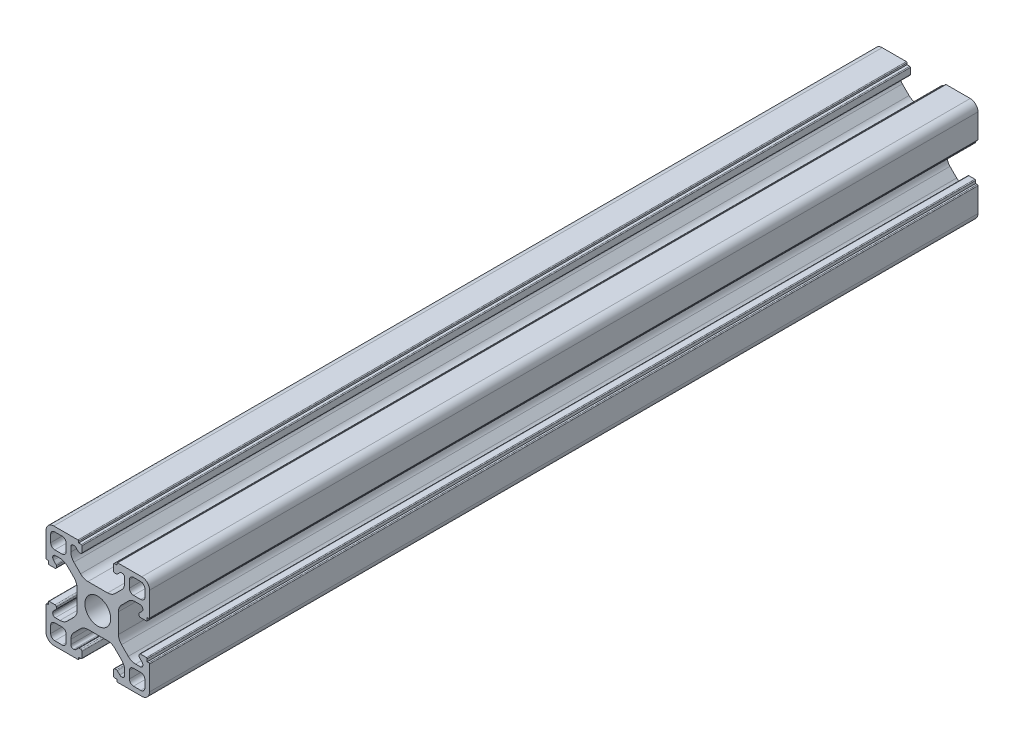
from build123d import *

# Parameters (mm, degrees)
EXTRUDE_1_DEPTH = 160


with BuildPart() as part:
    # Эскиз1 → Бобышка-Вытянуть1 (new body)
    with BuildSketch(Plane.XY):
        with BuildLine():
            Line((-31.105150957, 65.209647948), (-29.206370287, 65.209647948))
            ThreePointArc((-29.206370287, 65.209647948), (-28.441003423, 65.361888883), (-27.792156725, 65.795434385))
            Line((-27.792156725, 65.795434385), (-26.490937394, 67.096653716))
            ThreePointArc((-26.490937394, 67.096653716), (-26.057391892, 67.745500414), (-25.905150957, 68.510867279))
            Line((-25.905150957, 68.510867279), (-25.905150957, 69.409647948))
            ThreePointArc((-25.905150957, 69.409647948), (-26.051597566, 69.763201338), (-26.405150957, 69.909647948))
            Line((-26.405150957, 69.909647948), (-26.508044175, 69.909647948))
            ThreePointArc((-26.508044175, 69.909647948), (-26.699385892, 69.871587714), (-26.861597566, 69.763201338))
            Line((-26.861597566, 69.763201338), (-27.341927652, 69.282871252))
            ThreePointArc((-27.341927652, 69.282871252), (-27.423033489, 69.228678065), (-27.518704347, 69.209647948))
            Line((-27.518704347, 69.209647948), (-27.805150957, 69.209647948))
            ThreePointArc((-27.805150957, 69.209647948), (-27.981927652, 69.282871252), (-28.055150957, 69.459647948))
            Line((-28.055150957, 69.459647948), (-28.055150957, 70.608718768))
            ThreePointArc((-28.055150957, 70.608718768), (-28.011216974, 70.714784785), (-27.905150957, 70.758718768))
            Line((-27.905150957, 70.758718768), (-27.405150957, 70.758718768))
            Line((-27.405150957, 70.758718768), (-27.405150957, 71.059647948))
            ThreePointArc((-27.405150957, 71.059647948), (-27.361216974, 71.165713965), (-27.255150957, 71.209647948))
            Line((-27.255150957, 71.209647948), (-22.605150957, 71.209647948))
            ThreePointArc((-22.605150957, 71.209647948), (-21.544490785, 70.770308119), (-21.105150957, 69.709647948))
            Line((-21.105150957, 69.709647948), (-21.105150957, 65.059647948))
            ThreePointArc((-21.105150957, 65.059647948), (-21.149084939, 64.953581931), (-21.255150957, 64.909647948))
            Line((-21.255150957, 64.909647948), (-21.556080136, 64.909647948))
            Line((-21.556080136, 64.909647948), (-21.556080136, 64.409647948))
            ThreePointArc((-21.556080136, 64.409647948), (-21.600014119, 64.303581931), (-21.706080136, 64.259647948))
            Line((-21.706080136, 64.259647948), (-22.855150957, 64.259647948))
            ThreePointArc((-22.855150957, 64.259647948), (-23.031927652, 64.332871252), (-23.105150957, 64.509647948))
            Line((-23.105150957, 64.509647948), (-23.105150957, 64.796094557))
            ThreePointArc((-23.105150957, 64.796094557), (-23.08612084, 64.891765415), (-23.031927652, 64.972871252))
            Line((-23.031927652, 64.972871252), (-22.551597566, 65.453201338))
            ThreePointArc((-22.551597566, 65.453201338), (-22.44321119, 65.615413013), (-22.405150957, 65.806754729))
            Line((-22.405150957, 65.806754729), (-22.405150957, 65.909647948))
            ThreePointArc((-22.405150957, 65.909647948), (-22.551597566, 66.263201338), (-22.905150957, 66.409647948))
            Line((-22.905150957, 66.409647948), (-23.803931626, 66.409647948))
            ThreePointArc((-23.803931626, 66.409647948), (-24.56929849, 66.257407013), (-25.218145188, 65.82386151))
            Line((-25.218145188, 65.82386151), (-26.519364519, 64.522642179))
            ThreePointArc((-26.519364519, 64.522642179), (-26.952910022, 63.873795482), (-27.105150957, 63.108428617))
            Line((-27.105150957, 63.108428617), (-27.105150957, 61.209647948))
            Line((-27.105150957, 61.209647948), (-27.105150957, 59.310867279))
            ThreePointArc((-27.105150957, 59.310867279), (-26.952910022, 58.545500414), (-26.519364519, 57.896653716))
            Line((-26.519364519, 57.896653716), (-25.218145188, 56.595434385))
            ThreePointArc((-25.218145188, 56.595434385), (-24.56929849, 56.161888883), (-23.803931626, 56.009647948))
            Line((-23.803931626, 56.009647948), (-22.905150957, 56.009647948))
            ThreePointArc((-22.905150957, 56.009647948), (-22.551597566, 56.156094557), (-22.405150957, 56.509647948))
            Line((-22.405150957, 56.509647948), (-22.405150957, 56.612541166))
            ThreePointArc((-22.405150957, 56.612541166), (-22.44321119, 56.803882883), (-22.551597566, 56.966094557))
            Line((-22.551597566, 56.966094557), (-23.031927652, 57.446424643))
            ThreePointArc((-23.031927652, 57.446424643), (-23.08612084, 57.52753048), (-23.105150957, 57.623201338))
            Line((-23.105150957, 57.623201338), (-23.105150957, 57.909647948))
            ThreePointArc((-23.105150957, 57.909647948), (-23.031927652, 58.086424643), (-22.855150957, 58.159647948))
            Line((-22.855150957, 58.159647948), (-21.706080136, 58.159647948))
            ThreePointArc((-21.706080136, 58.159647948), (-21.600014119, 58.115713965), (-21.556080136, 58.009647948))
            Line((-21.556080136, 58.009647948), (-21.556080136, 57.509647948))
            Line((-21.556080136, 57.509647948), (-21.255150957, 57.509647948))
            ThreePointArc((-21.255150957, 57.509647948), (-21.149084939, 57.465713965), (-21.105150957, 57.359647948))
            Line((-21.105150957, 57.359647948), (-21.105150957, 52.709647948))
            ThreePointArc((-21.105150957, 52.709647948), (-21.544490785, 51.648987776), (-22.605150957, 51.209647948))
            Line((-22.605150957, 51.209647948), (-27.255150957, 51.209647948))
            ThreePointArc((-27.255150957, 51.209647948), (-27.361216974, 51.253581931), (-27.405150957, 51.359647948))
            Line((-27.405150957, 51.359647948), (-27.405150957, 51.660577127))
            Line((-27.405150957, 51.660577127), (-27.905150957, 51.660577127))
            ThreePointArc((-27.905150957, 51.660577127), (-28.011216974, 51.70451111), (-28.055150957, 51.810577127))
            Line((-28.055150957, 51.810577127), (-28.055150957, 52.959647948))
            ThreePointArc((-28.055150957, 52.959647948), (-27.981927652, 53.136424643), (-27.805150957, 53.209647948))
            Line((-27.805150957, 53.209647948), (-27.518704347, 53.209647948))
            ThreePointArc((-27.518704347, 53.209647948), (-27.423033489, 53.190617831), (-27.341927652, 53.136424643))
            Line((-27.341927652, 53.136424643), (-26.861597566, 52.656094557))
            ThreePointArc((-26.861597566, 52.656094557), (-26.699385892, 52.547708181), (-26.508044175, 52.509647948))
            Line((-26.508044175, 52.509647948), (-26.405150957, 52.509647948))
            ThreePointArc((-26.405150957, 52.509647948), (-26.051597566, 52.656094557), (-25.905150957, 53.009647948))
            Line((-25.905150957, 53.009647948), (-25.905150957, 53.908428617))
            ThreePointArc((-25.905150957, 53.908428617), (-26.057391892, 54.673795482), (-26.490937394, 55.322642179))
            Line((-26.490937394, 55.322642179), (-27.792156725, 56.62386151))
            ThreePointArc((-27.792156725, 56.62386151), (-28.441003423, 57.057407013), (-29.206370287, 57.209647948))
            Line((-29.206370287, 57.209647948), (-31.105150957, 57.209647948))
            Line((-31.105150957, 57.209647948), (-33.003931626, 57.209647948))
            ThreePointArc((-33.003931626, 57.209647948), (-33.76929849, 57.057407013), (-34.418145188, 56.62386151))
            Line((-34.418145188, 56.62386151), (-35.719364519, 55.322642179))
            ThreePointArc((-35.719364519, 55.322642179), (-36.152910022, 54.673795482), (-36.305150957, 53.908428617))
            Line((-36.305150957, 53.908428617), (-36.305150957, 53.009647948))
            ThreePointArc((-36.305150957, 53.009647948), (-36.158704347, 52.656094557), (-35.805150957, 52.509647948))
            Line((-35.805150957, 52.509647948), (-35.702257738, 52.509647948))
            ThreePointArc((-35.702257738, 52.509647948), (-35.510916022, 52.547708181), (-35.348704347, 52.656094557))
            Line((-35.348704347, 52.656094557), (-34.868374261, 53.136424643))
            ThreePointArc((-34.868374261, 53.136424643), (-34.787268424, 53.190617831), (-34.691597566, 53.209647948))
            Line((-34.691597566, 53.209647948), (-34.405150957, 53.209647948))
            ThreePointArc((-34.405150957, 53.209647948), (-34.228374261, 53.136424643), (-34.155150957, 52.959647948))
            Line((-34.155150957, 52.959647948), (-34.155150957, 51.810577127))
            ThreePointArc((-34.155150957, 51.810577127), (-34.199084939, 51.70451111), (-34.305150957, 51.660577127))
            Line((-34.305150957, 51.660577127), (-34.805150957, 51.660577127))
            Line((-34.805150957, 51.660577127), (-34.805150957, 51.359647948))
            ThreePointArc((-34.805150957, 51.359647948), (-34.849084939, 51.253581931), (-34.955150957, 51.209647948))
            Line((-34.955150957, 51.209647948), (-39.605150957, 51.209647948))
            ThreePointArc((-39.605150957, 51.209647948), (-40.665811128, 51.648987776), (-41.105150957, 52.709647948))
            Line((-41.105150957, 52.709647948), (-41.105150957, 57.359647948))
            ThreePointArc((-41.105150957, 57.359647948), (-41.061216974, 57.465713965), (-40.955150957, 57.509647948))
            Line((-40.955150957, 57.509647948), (-40.654221777, 57.509647948))
            Line((-40.654221777, 57.509647948), (-40.654221777, 58.009647948))
            ThreePointArc((-40.654221777, 58.009647948), (-40.610287794, 58.115713965), (-40.504221777, 58.159647948))
            Line((-40.504221777, 58.159647948), (-39.355150957, 58.159647948))
            ThreePointArc((-39.355150957, 58.159647948), (-39.178374261, 58.086424643), (-39.105150957, 57.909647948))
            Line((-39.105150957, 57.909647948), (-39.105150957, 57.623201338))
            ThreePointArc((-39.105150957, 57.623201338), (-39.124181073, 57.52753048), (-39.178374261, 57.446424643))
            Line((-39.178374261, 57.446424643), (-39.658704347, 56.966094557))
            ThreePointArc((-39.658704347, 56.966094557), (-39.767090723, 56.803882883), (-39.805150957, 56.612541166))
            Line((-39.805150957, 56.612541166), (-39.805150957, 56.509647948))
            ThreePointArc((-39.805150957, 56.509647948), (-39.658704347, 56.156094557), (-39.305150957, 56.009647948))
            Line((-39.305150957, 56.009647948), (-38.406370287, 56.009647948))
            ThreePointArc((-38.406370287, 56.009647948), (-37.641003423, 56.161888883), (-36.992156725, 56.595434385))
            Line((-36.992156725, 56.595434385), (-35.690937394, 57.896653716))
            ThreePointArc((-35.690937394, 57.896653716), (-35.257391892, 58.545500414), (-35.105150957, 59.310867279))
            Line((-35.105150957, 59.310867279), (-35.105150957, 61.209647948))
            Line((-35.105150957, 61.209647948), (-35.105150957, 63.108428617))
            ThreePointArc((-35.105150957, 63.108428617), (-35.257391892, 63.873795482), (-35.690937394, 64.522642179))
            Line((-35.690937394, 64.522642179), (-36.992156725, 65.82386151))
            ThreePointArc((-36.992156725, 65.82386151), (-37.641003423, 66.257407013), (-38.406370287, 66.409647948))
            Line((-38.406370287, 66.409647948), (-39.305150957, 66.409647948))
            ThreePointArc((-39.305150957, 66.409647948), (-39.658704347, 66.263201338), (-39.805150957, 65.909647948))
            Line((-39.805150957, 65.909647948), (-39.805150957, 65.806754729))
            ThreePointArc((-39.805150957, 65.806754729), (-39.767090723, 65.615413013), (-39.658704347, 65.453201338))
            Line((-39.658704347, 65.453201338), (-39.178374261, 64.972871252))
            ThreePointArc((-39.178374261, 64.972871252), (-39.124181073, 64.891765415), (-39.105150957, 64.796094557))
            Line((-39.105150957, 64.796094557), (-39.105150957, 64.509647948))
            ThreePointArc((-39.105150957, 64.509647948), (-39.178374261, 64.332871252), (-39.355150957, 64.259647948))
            Line((-39.355150957, 64.259647948), (-40.504221777, 64.259647948))
            ThreePointArc((-40.504221777, 64.259647948), (-40.610287794, 64.303581931), (-40.654221777, 64.409647948))
            Line((-40.654221777, 64.409647948), (-40.654221777, 64.909647948))
            Line((-40.654221777, 64.909647948), (-40.955150957, 64.909647948))
            ThreePointArc((-40.955150957, 64.909647948), (-41.061216974, 64.953581931), (-41.105150957, 65.059647948))
            Line((-41.105150957, 65.059647948), (-41.105150957, 69.709647948))
            ThreePointArc((-41.105150957, 69.709647948), (-40.665811128, 70.770308119), (-39.605150957, 71.209647948))
            Line((-39.605150957, 71.209647948), (-34.955150957, 71.209647948))
            ThreePointArc((-34.955150957, 71.209647948), (-34.849084939, 71.165713965), (-34.805150957, 71.059647948))
            Line((-34.805150957, 71.059647948), (-34.805150957, 70.758718768))
            Line((-34.805150957, 70.758718768), (-34.305150957, 70.758718768))
            ThreePointArc((-34.305150957, 70.758718768), (-34.199084939, 70.714784785), (-34.155150957, 70.608718768))
            Line((-34.155150957, 70.608718768), (-34.155150957, 69.459647948))
            ThreePointArc((-34.155150957, 69.459647948), (-34.228374261, 69.282871252), (-34.405150957, 69.209647948))
            Line((-34.405150957, 69.209647948), (-34.691597566, 69.209647948))
            ThreePointArc((-34.691597566, 69.209647948), (-34.787268424, 69.228678065), (-34.868374261, 69.282871252))
            Line((-34.868374261, 69.282871252), (-35.348704347, 69.763201338))
            ThreePointArc((-35.348704347, 69.763201338), (-35.510916022, 69.871587714), (-35.702257738, 69.909647948))
            Line((-35.702257738, 69.909647948), (-35.805150957, 69.909647948))
            ThreePointArc((-35.805150957, 69.909647948), (-36.158704347, 69.763201338), (-36.305150957, 69.409647948))
            Line((-36.305150957, 69.409647948), (-36.305150957, 68.510867279))
            ThreePointArc((-36.305150957, 68.510867279), (-36.152910022, 67.745500414), (-35.719364519, 67.096653716))
            Line((-35.719364519, 67.096653716), (-34.418145188, 65.795434385))
            ThreePointArc((-34.418145188, 65.795434385), (-33.76929849, 65.361888883), (-33.003931626, 65.209647948))
            Line((-33.003931626, 65.209647948), (-31.105150957, 65.209647948))
        make_face()
        with BuildLine():
            Line((-24.205150957, 67.309647948), (-22.805150957, 67.309647948))
            ThreePointArc((-22.805150957, 67.309647948), (-22.239465532, 67.543962523), (-22.005150957, 68.109647948))
            Line((-22.005150957, 68.109647948), (-22.005150957, 69.509647948))
            ThreePointArc((-22.005150957, 69.509647948), (-22.239465532, 70.075333373), (-22.805150957, 70.309647948))
            Line((-22.805150957, 70.309647948), (-24.205150957, 70.309647948))
            ThreePointArc((-24.205150957, 70.309647948), (-24.770836381, 70.075333373), (-25.005150957, 69.509647948))
            Line((-25.005150957, 69.509647948), (-25.005150957, 68.109647948))
            ThreePointArc((-25.005150957, 68.109647948), (-24.770836381, 67.543962523), (-24.205150957, 67.309647948))
        make_face(mode=Mode.SUBTRACT)
        with BuildLine():
            Line((-25.005150957, 54.309647948), (-25.005150957, 52.909647948))
            ThreePointArc((-25.005150957, 52.909647948), (-24.770836381, 52.343962523), (-24.205150957, 52.109647948))
            Line((-24.205150957, 52.109647948), (-22.805150957, 52.109647948))
            ThreePointArc((-22.805150957, 52.109647948), (-22.239465532, 52.343962523), (-22.005150957, 52.909647948))
            Line((-22.005150957, 52.909647948), (-22.005150957, 54.309647948))
            ThreePointArc((-22.005150957, 54.309647948), (-22.239465532, 54.875333373), (-22.805150957, 55.109647948))
            Line((-22.805150957, 55.109647948), (-24.205150957, 55.109647948))
            ThreePointArc((-24.205150957, 55.109647948), (-24.770836381, 54.875333373), (-25.005150957, 54.309647948))
        make_face(mode=Mode.SUBTRACT)
        with BuildLine():
            Line((-38.005150957, 55.109647948), (-39.405150957, 55.109647948))
            ThreePointArc((-39.405150957, 55.109647948), (-39.970836381, 54.875333373), (-40.205150957, 54.309647948))
            Line((-40.205150957, 54.309647948), (-40.205150957, 52.909647948))
            ThreePointArc((-40.205150957, 52.909647948), (-39.970836381, 52.343962523), (-39.405150957, 52.109647948))
            Line((-39.405150957, 52.109647948), (-38.005150957, 52.109647948))
            ThreePointArc((-38.005150957, 52.109647948), (-37.439465532, 52.343962523), (-37.205150957, 52.909647948))
            Line((-37.205150957, 52.909647948), (-37.205150957, 54.309647948))
            ThreePointArc((-37.205150957, 54.309647948), (-37.439465532, 54.875333373), (-38.005150957, 55.109647948))
        make_face(mode=Mode.SUBTRACT)
        with BuildLine():
            Line((-37.205150957, 68.109647948), (-37.205150957, 69.509647948))
            ThreePointArc((-37.205150957, 69.509647948), (-37.439465532, 70.075333373), (-38.005150957, 70.309647948))
            Line((-38.005150957, 70.309647948), (-39.405150957, 70.309647948))
            ThreePointArc((-39.405150957, 70.309647948), (-39.970836381, 70.075333373), (-40.205150957, 69.509647948))
            Line((-40.205150957, 69.509647948), (-40.205150957, 68.109647948))
            ThreePointArc((-40.205150957, 68.109647948), (-39.970836381, 67.543962523), (-39.405150957, 67.309647948))
            Line((-39.405150957, 67.309647948), (-38.005150957, 67.309647948))
            ThreePointArc((-38.005150957, 67.309647948), (-37.439465532, 67.543962523), (-37.205150957, 68.109647948))
        make_face(mode=Mode.SUBTRACT)
        with BuildLine():
            ThreePointArc((-28.605150957, 61.209647948), (-29.337384004, 62.977414901), (-31.105150957, 63.709647948))
            ThreePointArc((-31.105150957, 63.709647948), (-32.87291791, 62.977414901), (-33.605150957, 61.209647948))
            ThreePointArc((-33.605150957, 61.209647948), (-32.87291791, 59.441880995), (-31.105150957, 58.709647948))
            ThreePointArc((-31.105150957, 58.709647948), (-29.337384004, 59.441880995), (-28.605150957, 61.209647948))
        make_face(mode=Mode.SUBTRACT)
    extrude(amount=EXTRUDE_1_DEPTH)


solid = part.part
